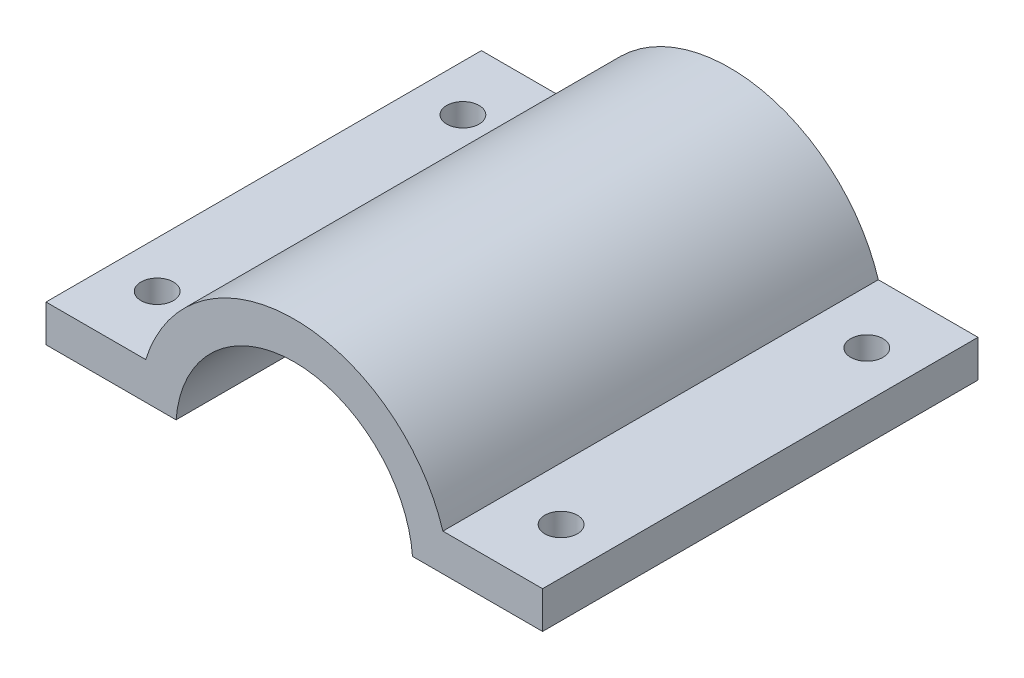
from build123d import *

# Parameters (mm, degrees)
BOSS_EXTRUDE1_DEPTH = 47
CUT_EXTRUDE1_REACH  = 57.376
SKETCH2_R           = 1.75


with BuildPart() as part:
    # Sketch1 → Boss-Extrude1 (new body)
    with BuildSketch(Plane(origin=(0, 0, 0), x_dir=(0, 1, 0), z_dir=(0, 0, 1))):
        with BuildLine():
            Line((1, 12.760877713), (1, 26.8))
            Line((1, 26.8), (5, 26.8))
            Line((5, 26.8), (5, 16.038703189))
            ThreePointArc((5, 16.038703189), (16.8, 0), (5, -16.038703189))
            Line((5, -16.038703189), (5, -26.8))
            Line((5, -26.8), (1, -26.8))
            Line((1, -26.8), (1, -12.760877713))
            ThreePointArc((1, -12.760877713), (12.8, 0), (1, 12.760877713))
        make_face()
    extrude(amount=BOSS_EXTRUDE1_DEPTH)

    # Sketch2 → Cut-Extrude1 (cut, up to next)
    with BuildSketch(Plane(origin=(0, 5, 0), x_dir=(-1, 0, 0), z_dir=(0, 1, 0)), mode=Mode.PRIVATE) as cut_extrude1_sk1:
        with Locations((-21.8, 40)):
            Circle(SKETCH2_R)
    cut_extrude1_tool1 = extrude(cut_extrude1_sk1.sketch, amount=-CUT_EXTRUDE1_REACH, mode=Mode.PRIVATE) & part.part
    # Sketch2 → Cut-Extrude1 (cut, up to next)
    with BuildSketch(Plane(origin=(0, 5, 0), x_dir=(-1, 0, 0), z_dir=(0, 1, 0)), mode=Mode.PRIVATE) as cut_extrude1_sk2:
        with Locations((-21.8, 7)):
            Circle(SKETCH2_R)
    cut_extrude1_tool2 = extrude(cut_extrude1_sk2.sketch, amount=-CUT_EXTRUDE1_REACH, mode=Mode.PRIVATE) & part.part
    # Sketch2 → Cut-Extrude1 (cut, up to next)
    with BuildSketch(Plane(origin=(0, 5, 0), x_dir=(-1, 0, 0), z_dir=(0, 1, 0)), mode=Mode.PRIVATE) as cut_extrude1_sk3:
        with Locations((21.8, 7)):
            Circle(SKETCH2_R)
    cut_extrude1_tool3 = extrude(cut_extrude1_sk3.sketch, amount=-CUT_EXTRUDE1_REACH, mode=Mode.PRIVATE) & part.part
    # Sketch2 → Cut-Extrude1 (cut, up to next)
    with BuildSketch(Plane(origin=(0, 5, 0), x_dir=(-1, 0, 0), z_dir=(0, 1, 0)), mode=Mode.PRIVATE) as cut_extrude1_sk4:
        with Locations((21.8, 40)):
            Circle(SKETCH2_R)
    cut_extrude1_tool4 = extrude(cut_extrude1_sk4.sketch, amount=-CUT_EXTRUDE1_REACH, mode=Mode.PRIVATE) & part.part
    add(cut_extrude1_tool1.solids().sort_by_distance((21.8, 5, 40))[0], mode=Mode.SUBTRACT)
    add(cut_extrude1_tool2.solids().sort_by_distance((21.8, 5, 7))[0], mode=Mode.SUBTRACT)
    add(cut_extrude1_tool3.solids().sort_by_distance((-21.8, 5, 7))[0], mode=Mode.SUBTRACT)
    add(cut_extrude1_tool4.solids().sort_by_distance((-21.8, 5, 40))[0], mode=Mode.SUBTRACT)


solid = part.part
